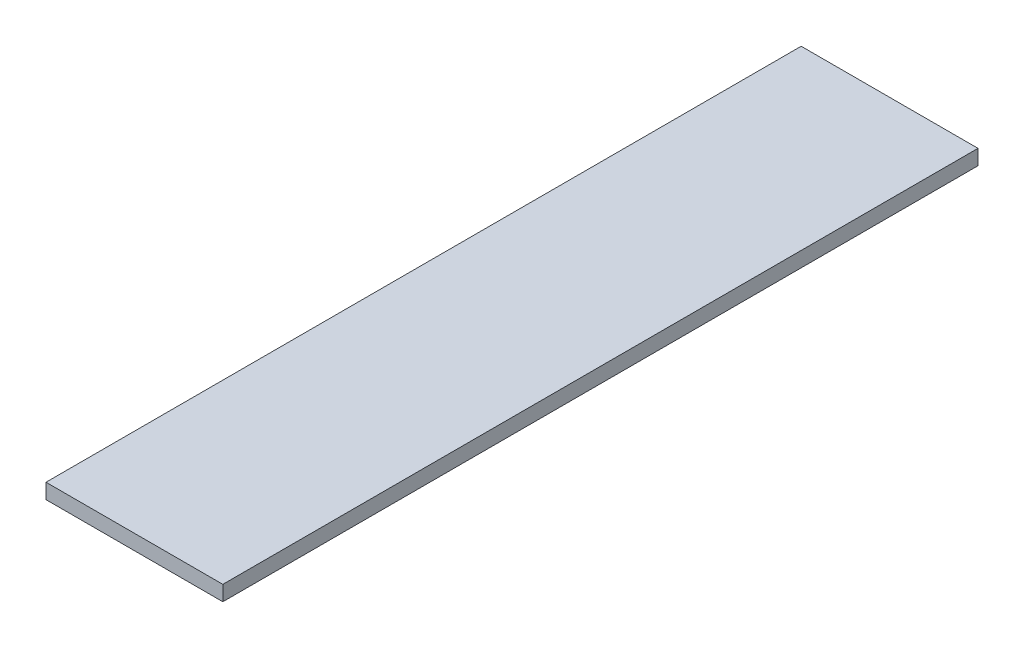
from build123d import *

# Parameters (mm, degrees)
SKETCH1_W           = 11.708313084
SKETCH1_H           = 1
BOSS_EXTRUDE1_DEPTH = 25


with BuildPart() as part:
    # Sketch1 → Boss-Extrude1 (new, symmetric)
    with BuildSketch(Plane.XY):
        with Locations((0, 56.198578917)):
            Rectangle(SKETCH1_W, SKETCH1_H)
    extrude(amount=BOSS_EXTRUDE1_DEPTH, both=True)


solid = part.part
